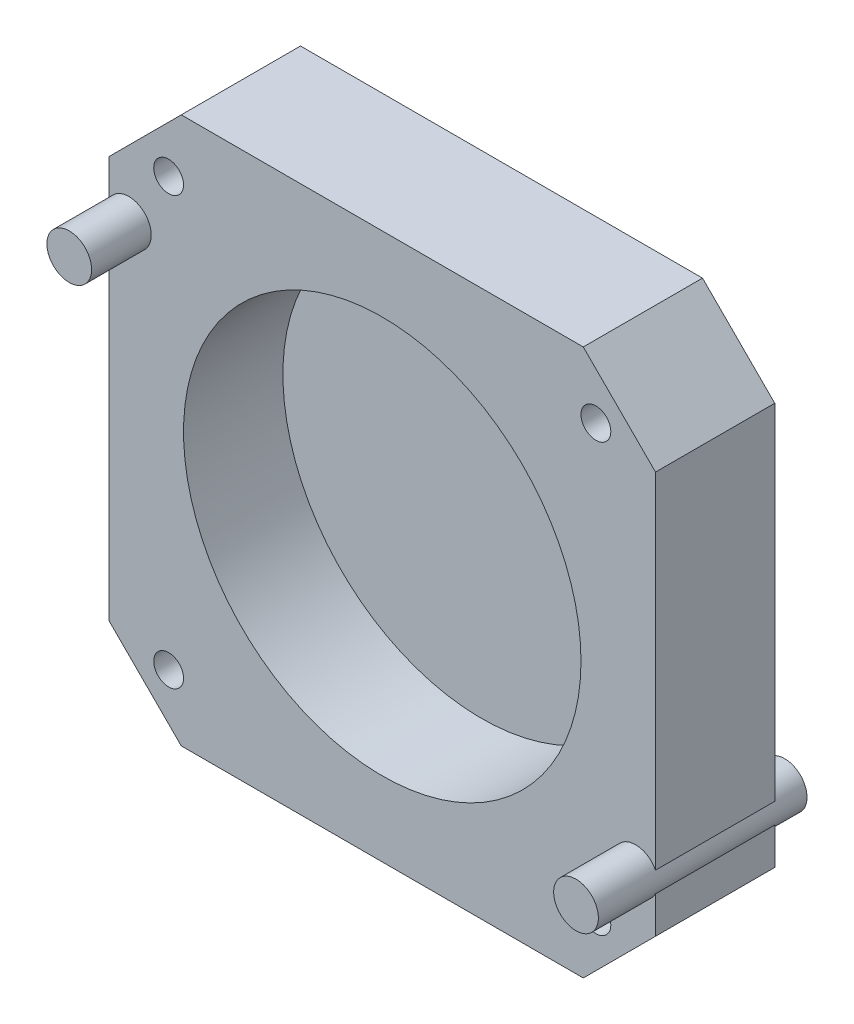
from build123d import *

# Parameters (mm, degrees)
SKETCH_1_W           = 55
SKETCH_1_H           = 55
EXTRUDE_1_DEPTH      = 12
CUT_EXTRUDE_1_REACH  = 42.7
SKETCH_2_R           = 1.5
SKETCH_3_R           = 20
CUT_EXTRUDE_2_DEPTH  = 10
CUT_EXTRUDE_3_REACH  = 42.7
EXTRUDE_2_DEPTH      = 6
EXTRUDE_2_DEPTH_BACK = 15
SKETCH_5_R           = 2.25
SKETCH_6_W           = 14
SKETCH_6_H           = 14
EXTRUDE_3_DEPTH      = 1
SKETCH_7_R           = 3.5
EXTRUDE_4_DEPTH      = 0.5
SKETCH_8_W           = 30
SKETCH_8_H           = 30
EXTRUDE_5_DEPTH      = 0.1


with BuildPart() as part:
    # 草图1 → 凸台-拉伸1 (new body)
    with BuildSketch(Plane.XY):
        Rectangle(SKETCH_1_W, SKETCH_1_H)
    extrude(amount=EXTRUDE_1_DEPTH)

    # 草图2 → 切除-拉伸1 (cut, up to next)
    with BuildSketch(Plane.XY.offset(12), mode=Mode.PRIVATE) as cut_extrude_1_sk1:
        with Locations((21.5, 21.5)):
            Circle(SKETCH_2_R)
    cut_extrude_1_tool1 = extrude(cut_extrude_1_sk1.sketch, amount=-CUT_EXTRUDE_1_REACH, mode=Mode.PRIVATE) & part.part
    # 草图2 → 切除-拉伸1 (cut, up to next)
    with BuildSketch(Plane.XY.offset(12), mode=Mode.PRIVATE) as cut_extrude_1_sk2:
        with Locations((21.5, -21.5)):
            Circle(SKETCH_2_R)
    cut_extrude_1_tool2 = extrude(cut_extrude_1_sk2.sketch, amount=-CUT_EXTRUDE_1_REACH, mode=Mode.PRIVATE) & part.part
    # 草图2 → 切除-拉伸1 (cut, up to next)
    with BuildSketch(Plane.XY.offset(12), mode=Mode.PRIVATE) as cut_extrude_1_sk3:
        with Locations((-21.5, -21.5)):
            Circle(SKETCH_2_R)
    cut_extrude_1_tool3 = extrude(cut_extrude_1_sk3.sketch, amount=-CUT_EXTRUDE_1_REACH, mode=Mode.PRIVATE) & part.part
    # 草图2 → 切除-拉伸1 (cut, up to next)
    with BuildSketch(Plane.XY.offset(12), mode=Mode.PRIVATE) as cut_extrude_1_sk4:
        with Locations((-21.5, 21.5)):
            Circle(SKETCH_2_R)
    cut_extrude_1_tool4 = extrude(cut_extrude_1_sk4.sketch, amount=-CUT_EXTRUDE_1_REACH, mode=Mode.PRIVATE) & part.part
    add(cut_extrude_1_tool1.solids().sort_by_distance((21.5, 21.5, 12))[0], mode=Mode.SUBTRACT)
    add(cut_extrude_1_tool2.solids().sort_by_distance((21.5, -21.5, 12))[0], mode=Mode.SUBTRACT)
    add(cut_extrude_1_tool3.solids().sort_by_distance((-21.5, -21.5, 12))[0], mode=Mode.SUBTRACT)
    add(cut_extrude_1_tool4.solids().sort_by_distance((-21.5, 21.5, 12))[0], mode=Mode.SUBTRACT)

    # 草图3 → 切除-拉伸2 (cut)
    with BuildSketch(Plane.XY.offset(12)):
        Circle(SKETCH_3_R)
    extrude(amount=-CUT_EXTRUDE_2_DEPTH, mode=Mode.SUBTRACT)

    # 草图4 → 切除-拉伸3 (cut, up to next)
    with BuildSketch(Plane.XY.offset(12), mode=Mode.PRIVATE) as cut_extrude_3_sk1:
        Polygon((-27.5, 20.22970773), (-20.22970773, 27.5), (-27.5, 27.5), align=None)
    cut_extrude_3_tool1 = extrude(cut_extrude_3_sk1.sketch, amount=-CUT_EXTRUDE_3_REACH, mode=Mode.PRIVATE) & part.part
    # 草图4 → 切除-拉伸3 (cut, up to next)
    with BuildSketch(Plane.XY.offset(12), mode=Mode.PRIVATE) as cut_extrude_3_sk2:
        Polygon((20.22970773, -27.5), (27.5, -20.22970773), (27.5, -27.5), align=None)
    cut_extrude_3_tool2 = extrude(cut_extrude_3_sk2.sketch, amount=-CUT_EXTRUDE_3_REACH, mode=Mode.PRIVATE) & part.part
    # 草图4 → 切除-拉伸3 (cut, up to next)
    with BuildSketch(Plane.XY.offset(12), mode=Mode.PRIVATE) as cut_extrude_3_sk3:
        Polygon((20.22970773, 27.5), (27.5, 20.22970773), (27.5, 27.5), align=None)
    cut_extrude_3_tool3 = extrude(cut_extrude_3_sk3.sketch, amount=-CUT_EXTRUDE_3_REACH, mode=Mode.PRIVATE) & part.part
    # 草图4 → 切除-拉伸3 (cut, up to next)
    with BuildSketch(Plane.XY.offset(12), mode=Mode.PRIVATE) as cut_extrude_3_sk4:
        Polygon((-20.22970773, -27.5), (-27.5, -27.5), (-27.5, -20.22970773), align=None)
    cut_extrude_3_tool4 = extrude(cut_extrude_3_sk4.sketch, amount=-CUT_EXTRUDE_3_REACH, mode=Mode.PRIVATE) & part.part
    add(cut_extrude_3_tool1.solids().sort_by_distance((-25.076569, 25.076569, 12))[0], mode=Mode.SUBTRACT)
    add(cut_extrude_3_tool2.solids().sort_by_distance((25.076569, -25.076569, 12))[0], mode=Mode.SUBTRACT)
    add(cut_extrude_3_tool3.solids().sort_by_distance((25.076569, 25.076569, 12))[0], mode=Mode.SUBTRACT)
    add(cut_extrude_3_tool4.solids().sort_by_distance((-25.076569, -25.076569, 12))[0], mode=Mode.SUBTRACT)

    # 草图5 → 凸台-拉伸2 (add, two sides: drawn at the far end of the back side and taken through both)
    with BuildSketch(Plane.XY.offset(12).offset(-EXTRUDE_2_DEPTH_BACK)):
        with Locations((-25.5, 15.5)):
            Circle(SKETCH_5_R)
        with Locations((25.5, -15.5)):
            Circle(SKETCH_5_R)
    extrude(amount=EXTRUDE_2_DEPTH + EXTRUDE_2_DEPTH_BACK)

    # 草图6 → 凸台-拉伸3 (add)
    with BuildSketch(Plane(origin=(0, 0, 0), x_dir=(-1, 0, 0), z_dir=(0, 0, -1))):
        Rectangle(SKETCH_6_W, SKETCH_6_H)
    extrude(amount=EXTRUDE_3_DEPTH)

    # 草图7 → 凸台-拉伸4 (add)
    with BuildSketch(Plane(origin=(0, 0, -1), x_dir=(-1, 0, 0), z_dir=(0, 0, -1))):
        Circle(SKETCH_7_R)
    extrude(amount=EXTRUDE_4_DEPTH)

    # 草图8 → 凸台-拉伸5 (add)
    with BuildSketch(Plane(origin=(0, 0, 0), x_dir=(-1, 0, 0), z_dir=(0, 0, -1))):
        Rectangle(SKETCH_8_W, SKETCH_8_H)
    extrude(amount=EXTRUDE_5_DEPTH)


solid = part.part
